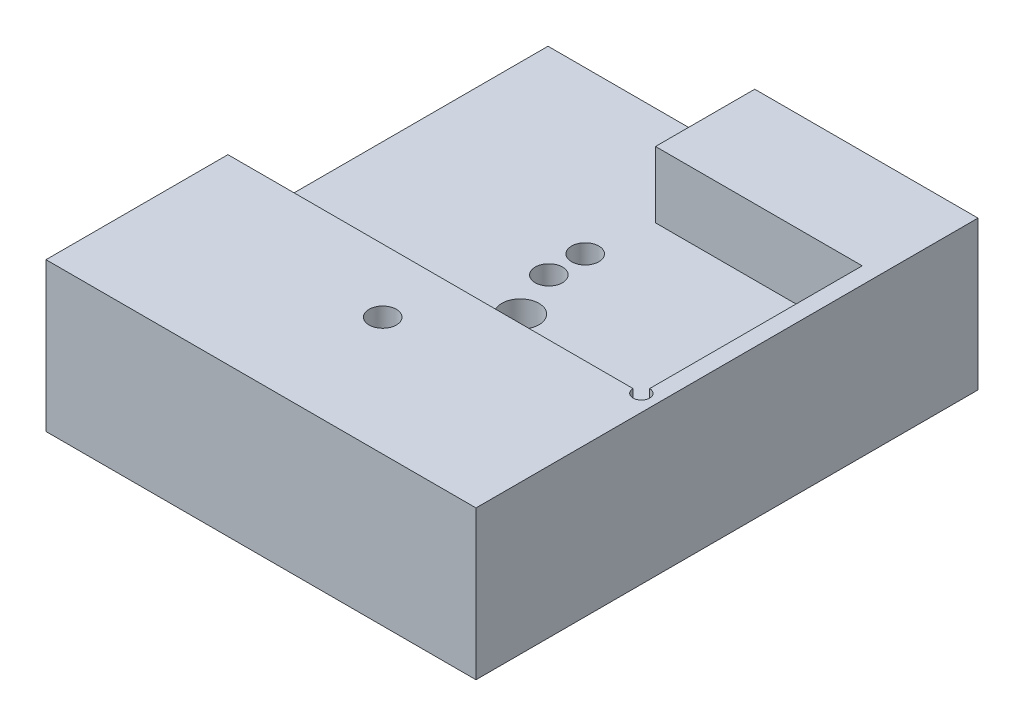
from build123d import *

# Parameters (mm, degrees)
SKETCH_1_W                = 50
SKETCH_1_H                = 26.71
EXTRUDE_1_DEPTH           = 6
EXTRUDE_2_DEPTH           = 8
EXTRUDE_2_DEPTH_BACK      = 6
HOLE_WIZARD_M4_1_D        = 3.3
HOLE_WIZARD_M4_1_DEPTH    = 10.1
HOLE_WIZARD_M4_1_TIP      = 0.991420021
SKETCH_12_W               = 2
SKETCH_12_H               = 8
CUT_EXTRUDE_5_DEPTH       = 25
EXTRUDE_5_DEPTH           = 10
SKETCH_25_W               = 52
SKETCH_25_H               = 14
EXTRUDE_6_DEPTH           = 20
SKETCH_13_R               = 1
CUT_EXTRUDE_6_DEPTH       = 8
SKETCH_5_W                = 25
SKETCH_5_H                = 25
SKETCH_5_R                = 1.193891983
CUT_EXTRUDE_1_DEPTH       = 2
HOLE_WIZARD_M4_2_D        = 3.3
SKETCH_14_W               = 52
SKETCH_14_H               = 60.71
SKETCH_14_W_2             = 25
SKETCH_14_H_2             = 25
EXTRUDE_3_DEPTH           = 4
SKETCH_16_W               = 25
SKETCH_16_H               = 25
CUT_EXTRUDE_7_DEPTH       = 1.84
HOLE_WIZARD_0_D           = 4.5
HOLE_WIZARD_0_CBORE_D     = 8
HOLE_WIZARD_0_CBORE_DEPTH = 4.6
HOLE_WIZARD_M4_3_D        = 3.3


with BuildPart() as part:
    # 草图1 → 凸台-拉伸1 (new body)
    with BuildSketch(Plane(origin=(0, 0, 0), x_dir=(1, 0, 0), z_dir=(0, 1, 0))):
        Rectangle(SKETCH_1_W, SKETCH_1_H)
    extrude(amount=EXTRUDE_1_DEPTH)

    # 草图2 → 凸台-拉伸2 (add, two sides: drawn at the far end of the back side and taken through both)
    with BuildSketch(Plane(origin=(0, 6, 0), x_dir=(1, 0, 0), z_dir=(0, 1, 0)).offset(-EXTRUDE_2_DEPTH_BACK)):
        Polygon((25, 13.355), (-25, 13.355), (-25, 15.355), (27, 15.355), (27, -15.355), (-25, -15.355), (-25, -13.355), (25, -13.355), align=None)
    extrude(amount=EXTRUDE_2_DEPTH + EXTRUDE_2_DEPTH_BACK)

    # M4 螺纹孔1
    with Locations(Plane(origin=(-1, 6, -5.855), x_dir=(0, 0, 1), z_dir=(0, 1, 0))):
        with Locations((0, 0)):
            Hole(HOLE_WIZARD_M4_1_D / 2, depth=HOLE_WIZARD_M4_1_DEPTH)
            with Locations((0, 0, -(HOLE_WIZARD_M4_1_DEPTH + HOLE_WIZARD_M4_1_TIP / 2))):  # 118° drill point
                Cone(0, HOLE_WIZARD_M4_1_D / 2, HOLE_WIZARD_M4_1_TIP, mode=Mode.SUBTRACT)

    # 草图12 → 切除-拉伸5 (cut)
    with BuildSketch(Plane.ZY.offset(25)):
        with Locations((-14.355, 10)):
            Rectangle(SKETCH_12_W, SKETCH_12_H)
    extrude(amount=-CUT_EXTRUDE_5_DEPTH, mode=Mode.SUBTRACT)

    # 草图24 → 凸台-拉伸5 (add)
    with BuildSketch(Plane(origin=(0, 0, -15.355), x_dir=(-1, 0, 0), z_dir=(0, 0, -1))):
        Polygon((25, 6), (0, 6), (0, 14), (-27, 14), (-27, 0), (25, 0), align=None)
    extrude(amount=EXTRUDE_5_DEPTH)

    # 草图25 → 凸台-拉伸6 (add)
    with BuildSketch(Plane.XY.offset(15.355)):
        with Locations((1, 7)):
            Rectangle(SKETCH_25_W, SKETCH_25_H)
    extrude(amount=EXTRUDE_6_DEPTH)

    # 草图13 → 切除-拉伸6 (cut)
    with BuildSketch(Plane(origin=(0, 14, 0), x_dir=(1, 0, 0), z_dir=(0, 1, 0))):
        with Locations((25, -13.355)):
            Circle(SKETCH_13_R)
    extrude(amount=-CUT_EXTRUDE_6_DEPTH, mode=Mode.SUBTRACT)

    # 草图5 → 切除-拉伸1 (cut)
    with BuildSketch(Plane.XZ):
        with Locations((-1, -1.455)):
            Rectangle(SKETCH_5_W, SKETCH_5_H)
        with Locations(Location((-1, -1.455, 0), (0, 0, 270))):
            Circle(SKETCH_5_R, mode=Mode.SUBTRACT)
    extrude(amount=-CUT_EXTRUDE_1_DEPTH, mode=Mode.SUBTRACT)

    # M4 螺纹孔2 (through all)
    with Locations(Plane(origin=(-1, 2, -1.455), x_dir=(0, 0, -1), z_dir=(0, -1, 0))):
        with Locations((0, 0)):
            Hole(HOLE_WIZARD_M4_2_D / 2)

    # 草图14 → 凸台-拉伸3 (add)
    with BuildSketch(Plane.XZ):
        with Locations((1, 5)):
            Rectangle(SKETCH_14_W, SKETCH_14_H)
        with Locations((-1, -1.455)):
            Rectangle(SKETCH_14_W_2, SKETCH_14_H_2, mode=Mode.SUBTRACT)
    extrude(amount=EXTRUDE_3_DEPTH)

    # 草图16 → 切除-拉伸7 (cut)
    with BuildSketch(Plane.XZ.offset(4)):
        with Locations((1.38, 21.365)):
            Rectangle(SKETCH_16_W, SKETCH_16_H)
    extrude(amount=-CUT_EXTRUDE_7_DEPTH, mode=Mode.SUBTRACT)

    # 打孔尺寸(%根据)内六角圆柱头螺钉的类型0 (through all)
    with Locations(Plane(origin=(1.378, -4, 4.369489244), x_dir=(0, 0, -1), z_dir=(0, -1, 0))):
        with Locations((0, 0)):
            CounterBoreHole(HOLE_WIZARD_0_D / 2, HOLE_WIZARD_0_CBORE_D / 2, HOLE_WIZARD_0_CBORE_DEPTH)

    # M4 螺纹孔3 (through all)
    with Locations(Plane(origin=(1.38, -2.16, 21.015906409), x_dir=(0, 0, -1), z_dir=(0, -1, 0))):
        with Locations((0, 0)):
            Hole(HOLE_WIZARD_M4_3_D / 2)


solid = part.part
